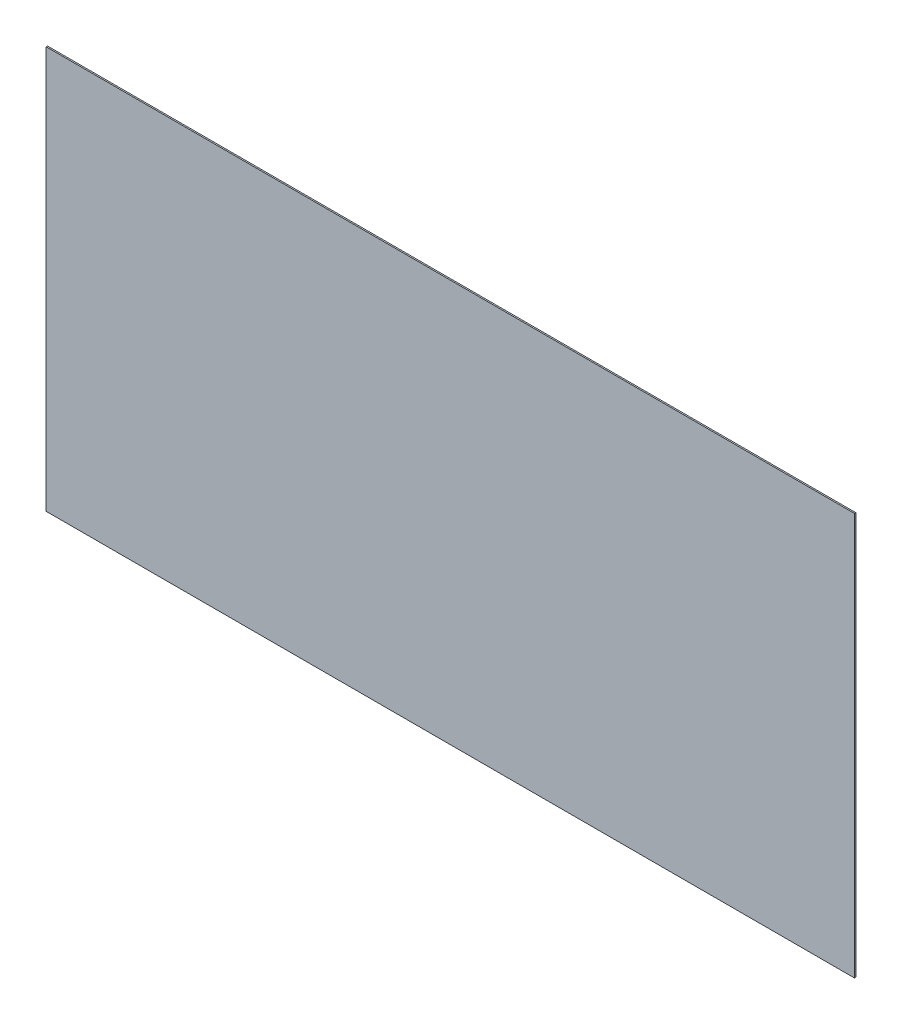
from build123d import *

# Parameters (mm, degrees)
CEK_1L_KUTU_ARKA_1_0_1_START = -699
SKETCH1_W                    = 590.6
SKETCH1_H                    = 294
CEK_1L_KUTU_ARKA_1_0_1_DEPTH = 1


with BuildPart() as part:
    # Sketch1 → CEK_1L_kutu_arka_1.0_1 (new body)
    with BuildSketch(Plane.XY.offset(CEK_1L_KUTU_ARKA_1_0_1_START)):
        with Locations((309, 151)):
            Rectangle(SKETCH1_W, SKETCH1_H)
    extrude(amount=-CEK_1L_KUTU_ARKA_1_0_1_DEPTH)


solid = part.part
